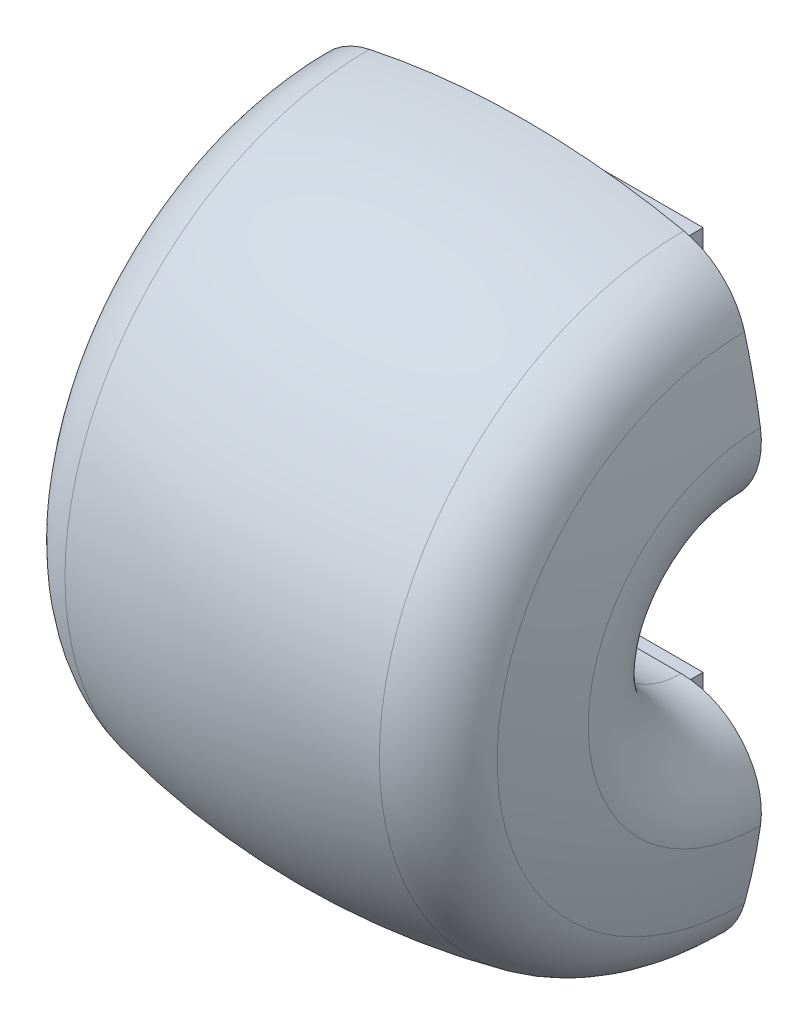
from build123d import *

# Parameters (mm, degrees)
REVOLVE_1_ANGLE = 180
FILLET_1_R      = 5
FILLET_2_R      = 5
SKETCH_3_W      = 10
SKETCH_3_H      = 3.5
EXTRUDE_1_DEPTH = 6


with BuildPart() as part:
    # 草图1 → 旋转1 (revolve)
    with BuildSketch(Plane.XY):
        with BuildLine():
            Line((-15, 5), (15, 5))
            ThreePointArc((15, 5), (14.412847263, 11.739422714), (12.669081334, 18.275770872))
            ThreePointArc((12.669081334, 18.275770872), (0, 20), (-12.669081334, 18.275770872))
            ThreePointArc((-12.669081334, 18.275770872), (-14.412847263, 11.739422714), (-15, 5))
        make_face()
    revolve(axis=Axis((-17.5, 0, 0), (1, 0, 0)), revolution_arc=REVOLVE_1_ANGLE)

    # 圆角1
    fillet_1_edges = [part.edges().sort_by_distance(p)[0] for p in [
        (12.669081334, 0, 18.275770872),
        (-12.669081334, 0, 18.275770872),
    ]]
    fillet(fillet_1_edges, radius=FILLET_1_R)

    # 圆角2
    fillet_2_edges = [part.edges().sort_by_distance(p)[0] for p in [
        (-15, 0, 5),
        (15, 0, 5),
    ]]
    fillet(fillet_2_edges, radius=FILLET_2_R)

    # 草图3 → 凸台-拉伸1 (add)
    with BuildSketch(Plane(origin=(0, 0, 0), x_dir=(-1, 0, 0), z_dir=(0, 0, -1))):
        with Locations((0, 12)):
            Rectangle(SKETCH_3_W, SKETCH_3_H)
        with Locations((0, -12)):
            Rectangle(SKETCH_3_W, SKETCH_3_H)
    extrude(amount=EXTRUDE_1_DEPTH)


solid = part.part
